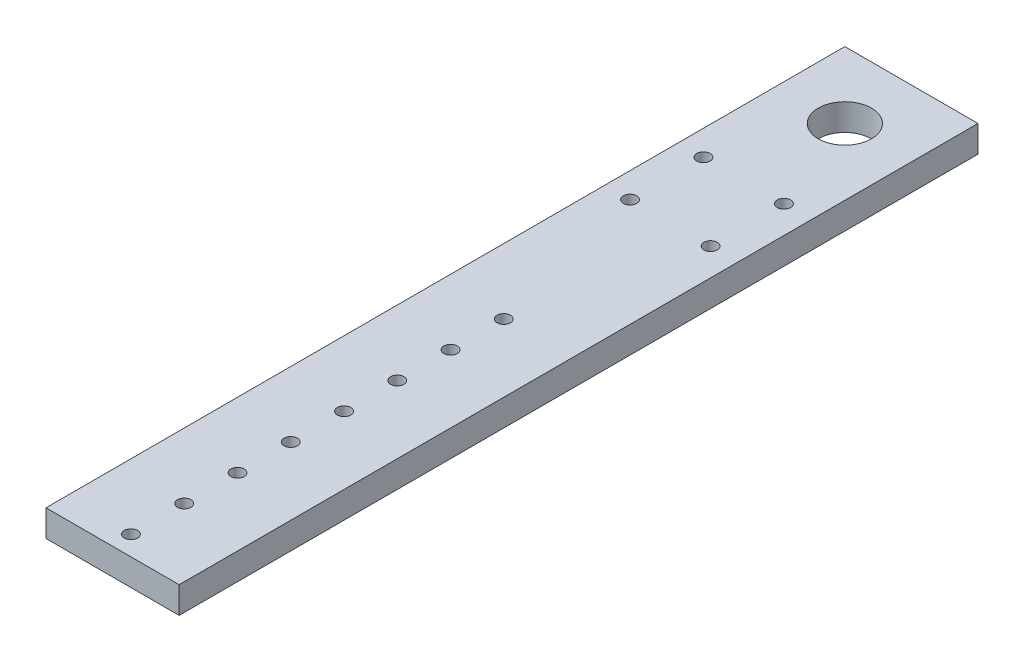
from build123d import *

# Parameters (mm, degrees)
SKETCH1_W                  = 127
SKETCH1_H                  = 762
BOSS_EXTRUDE1_DEPTH        = 25.4
F_1_2_0_5_DIAMETER_HOLE1_D = 50.8
F_1_2_0_5_DIAMETER_HOLE2_D = 12.7


with BuildPart() as part:
    # Sketch1 → Boss-Extrude1 (new body)
    with BuildSketch(Plane(origin=(0, 0, 0), x_dir=(1, 0, 0), z_dir=(0, 1, 0))):
        with Locations((-63.5, 381)):
            Rectangle(SKETCH1_W, SKETCH1_H)
    extrude(amount=BOSS_EXTRUDE1_DEPTH)

    # 1/2 (0.5) Diameter Hole1 (through all)
    with Locations(Plane(origin=(-63.5, 25.4, -698.5), x_dir=(0, 0, 1), z_dir=(0, 1, 0))):
        with Locations((0, 0)):
            Hole(F_1_2_0_5_DIAMETER_HOLE1_D / 2)

    # 1/2 (0.5) Diameter Hole2 (through all)
    with Locations(Plane(origin=(0, 25.4, 0), x_dir=(1, 0, 0), z_dir=(0, 1, 0))):
        with Locations((-103.026104377, 603.131071739), (-64.620447093, 374.288503187), (-26.214789808, 603.131071739), (-26.214789808, 533.157431448), (-103.026104377, 533.157431448), (-64.620447093, 323.488503187), (-64.620447093, 272.688503187), (-64.620447093, 221.888503187), (-64.620447093, 171.088503187), (-64.620447093, 120.288503187), (-64.620447093, 69.488503187), (-64.620447093, 18.688503187), (-64.620447093, -32.111496813)):
            Hole(F_1_2_0_5_DIAMETER_HOLE2_D / 2)


solid = part.part
